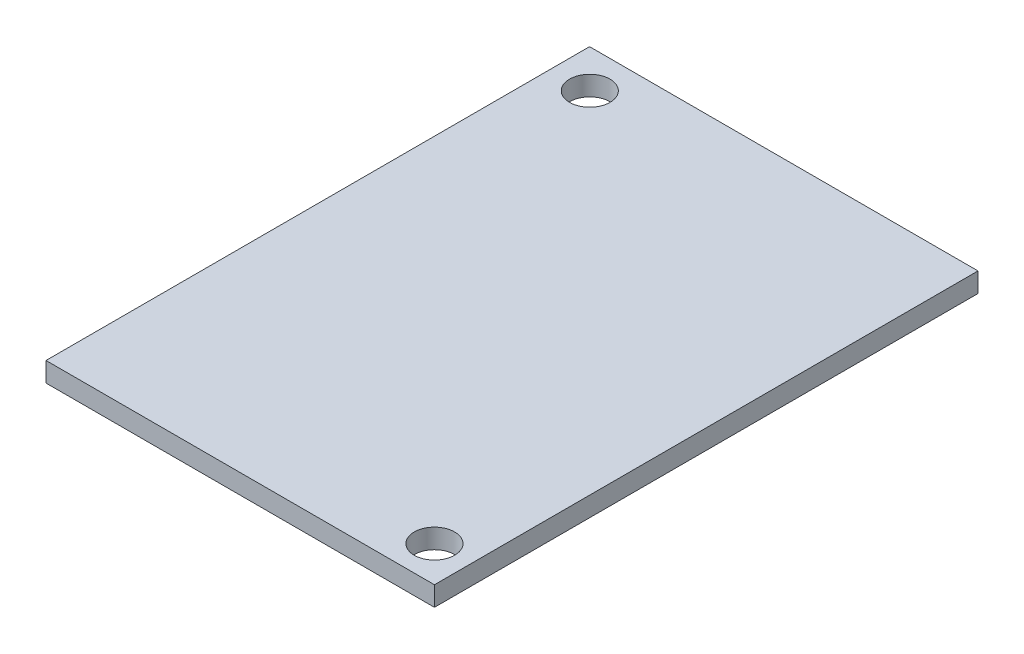
from build123d import *

# Parameters (mm, degrees)
SKETCH1_W           = 31.73
SKETCH1_H           = 44.4
BOSS_EXTRUDE1_DEPTH = 1.6
SKETCH2_R           = 1.65
CUT_EXTRUDE1_DEPTH  = 55.595905524


with BuildPart() as part:
    # Sketch1 → Boss-Extrude1 (new body)
    with BuildSketch(Plane(origin=(0, 0, 0), x_dir=(1, 0, 0), z_dir=(0, 1, 0))):
        with Locations((15.865, 22.2)):
            Rectangle(SKETCH1_W, SKETCH1_H)
    extrude(amount=BOSS_EXTRUDE1_DEPTH)

    # Sketch2 → Cut-Extrude1 (cut, through all)
    with BuildSketch(Plane(origin=(0, 1.6, 0), x_dir=(1, 0, 0), z_dir=(0, 1, 0))):
        with Locations(Location((3.13, 41.29, 0), (0, 0, 270))):
            Circle(SKETCH2_R)
        with Locations(Location((28.82, 2.91, 0), (0, 0, 270))):
            Circle(SKETCH2_R)
    extrude(amount=-CUT_EXTRUDE1_DEPTH, mode=Mode.SUBTRACT)


solid = part.part
